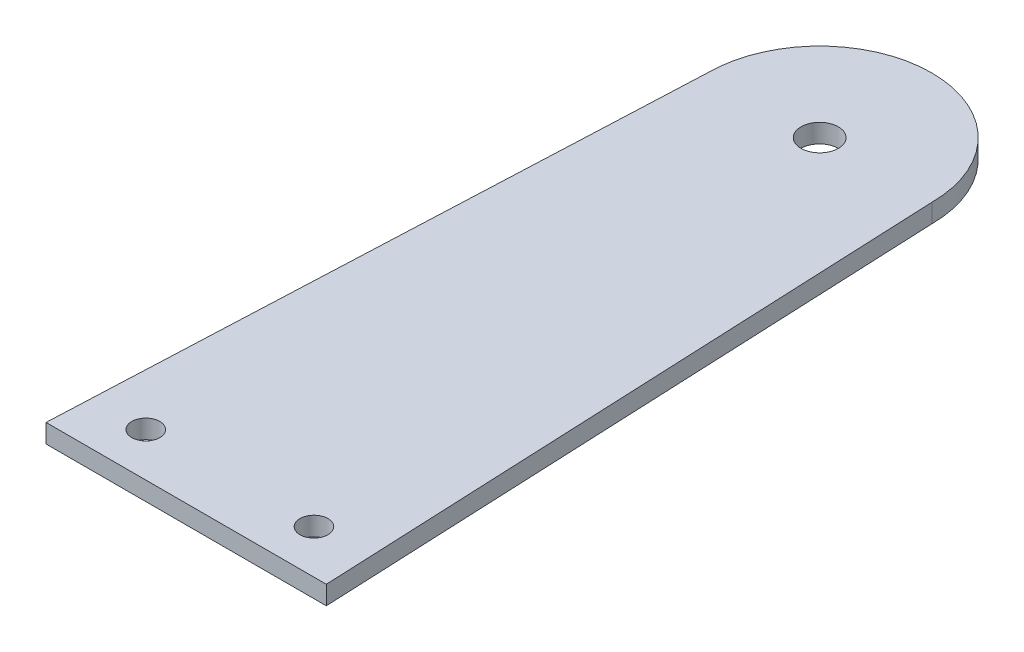
from build123d import *

# Parameters (mm, degrees)
SKETCH_1_R      = 1.5
SKETCH_1_R_2    = 2
EXTRUDE_1_DEPTH = 2


with BuildPart() as part:
    # Эскиз1 → Бобышка-Вытянуть1 (new body)
    with BuildSketch(Plane(origin=(0, 0, 0), x_dir=(1, 0, 0), z_dir=(0, 1, 0))):
        with BuildLine():
            Line((-17.625227915, -29.617278809), (12.374772085, -29.617278809))
            Line((12.374772085, -29.617278809), (9.374772085, 38.182721191))
            ThreePointArc((9.374772085, 38.182721191), (-2.625227915, 50.182721191), (-14.625227915, 38.182721191))
            Line((-14.625227915, 38.182721191), (-17.625227915, -29.617278809))
        make_face()
        with Locations(Location((-11.625227915, -24.937945637, 0), (0, 0, 270))):
            Circle(SKETCH_1_R, mode=Mode.SUBTRACT)
        with Locations(Location((6.374772085, -24.937945637, 0), (0, 0, 270))):
            Circle(SKETCH_1_R, mode=Mode.SUBTRACT)
        with Locations(Location((-2.625227915, 38.182721191, 0), (0, 0, 270))):
            Circle(SKETCH_1_R_2, mode=Mode.SUBTRACT)
    extrude(amount=EXTRUDE_1_DEPTH)


solid = part.part
